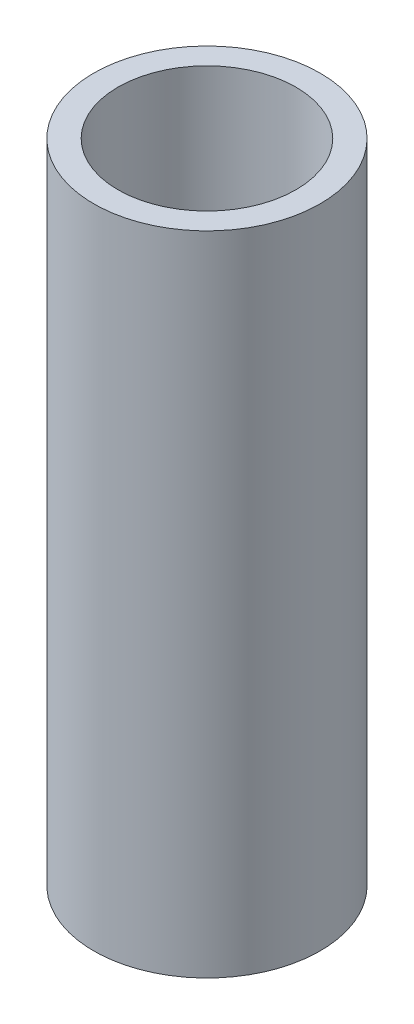
from build123d import *

# Parameters (mm, degrees)
SKETCH_1_W          = 7
SKETCH_1_H          = 40
SKETCH_2_R          = 5.5
CUT_EXTRUDE_1_DEPTH = 35


with BuildPart() as part:
    # 草图1 → 旋转4 (revolve)
    with BuildSketch(Plane(origin=(0, 0, 0), x_dir=(0, 0, -1), z_dir=(1, 0, 0)), mode=Mode.PRIVATE) as revolve_4_sk:
        with Locations((-3.5, 20)):
            Rectangle(SKETCH_1_W, SKETCH_1_H)
    revolve(revolve_4_sk.sketch.rotate(Axis((0, 0, 0), (0, 1, 0)), 180), axis=Axis((0, 0, 0), (0, 1, 0)))

    # 草图2 → 切除-拉伸1 (cut)
    with BuildSketch(Plane(origin=(0, 40, 0), x_dir=(1, 0, 0), z_dir=(0, 1, 0))):
        with Locations(Location((0, 0, 0), (0, 0, 270))):
            Circle(SKETCH_2_R)
    extrude(amount=-CUT_EXTRUDE_1_DEPTH, mode=Mode.SUBTRACT)


solid = part.part
